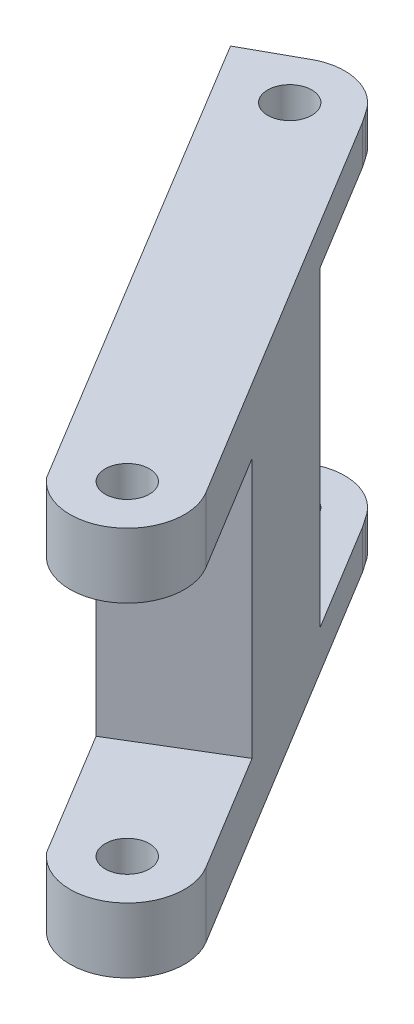
from build123d import *

# Parameters (mm, degrees)
SKETCH1_R           = 1.7
BOSS_EXTRUDE3_DEPTH = 30
SKETCH3_W           = 15
SKETCH3_H           = 24
SKETCH3_H_2         = 20
CUT_EXTRUDE1_DEPTH  = 30


with BuildPart() as part:
    # Sketch1 → Boss-Extrude3 (new body)
    with BuildSketch(Plane(origin=(0, 0, 0), x_dir=(1, 0, 0), z_dir=(0, 1, 0))):
        with BuildLine():
            Line((-5.313882261, 48.296626618), (-9.168605584, 46.167598374))
            Line((-9.168605584, 46.167598374), (11.814117054, 11.491925283))
            Line((11.814117054, 11.491925283), (12.539193688, 10.293676573))
            ThreePointArc((12.539193688, 10.293676573), (18.482268259, 9.569826652), (19.671887971, 15.437441074))
            Line((19.671887971, 15.437441074), (1.001872335, 46.167598374))
            Line((1.001872335, 46.167598374), (0.516004793, 46.873367152))
            ThreePointArc((0.516004793, 46.873367152), (-2.104172047, 48.792406027), (-5.313882261, 48.296626618))
        make_face()
        with Locations(Location((15.902373856, 13.147283989, 0), (0, 0, 270))):
            Circle(SKETCH1_R, mode=Mode.SUBTRACT)
        with Locations(Location((-3.110568467, 44.670053358, 0), (0, 0, 270))):
            Circle(SKETCH1_R, mode=Mode.SUBTRACT)
    extrude(amount=BOSS_EXTRUDE3_DEPTH)

    # Sketch3 → Cut-Extrude1 (cut)
    with BuildSketch(Plane(origin=(13.737778319, 0, -8.312916994), x_dir=(0.5177090511258458, 0, 0.8555567417666561), z_dir=(-0.8555567417666561, 0, 0.5177090511258458))):
        with Locations((-36.745670137, 15)):
            Rectangle(SKETCH3_W, SKETCH3_H)
        with Locations((-6.104769326, 15)):
            Rectangle(SKETCH3_W, SKETCH3_H_2)
    extrude(amount=-CUT_EXTRUDE1_DEPTH, mode=Mode.SUBTRACT)


solid = part.part
